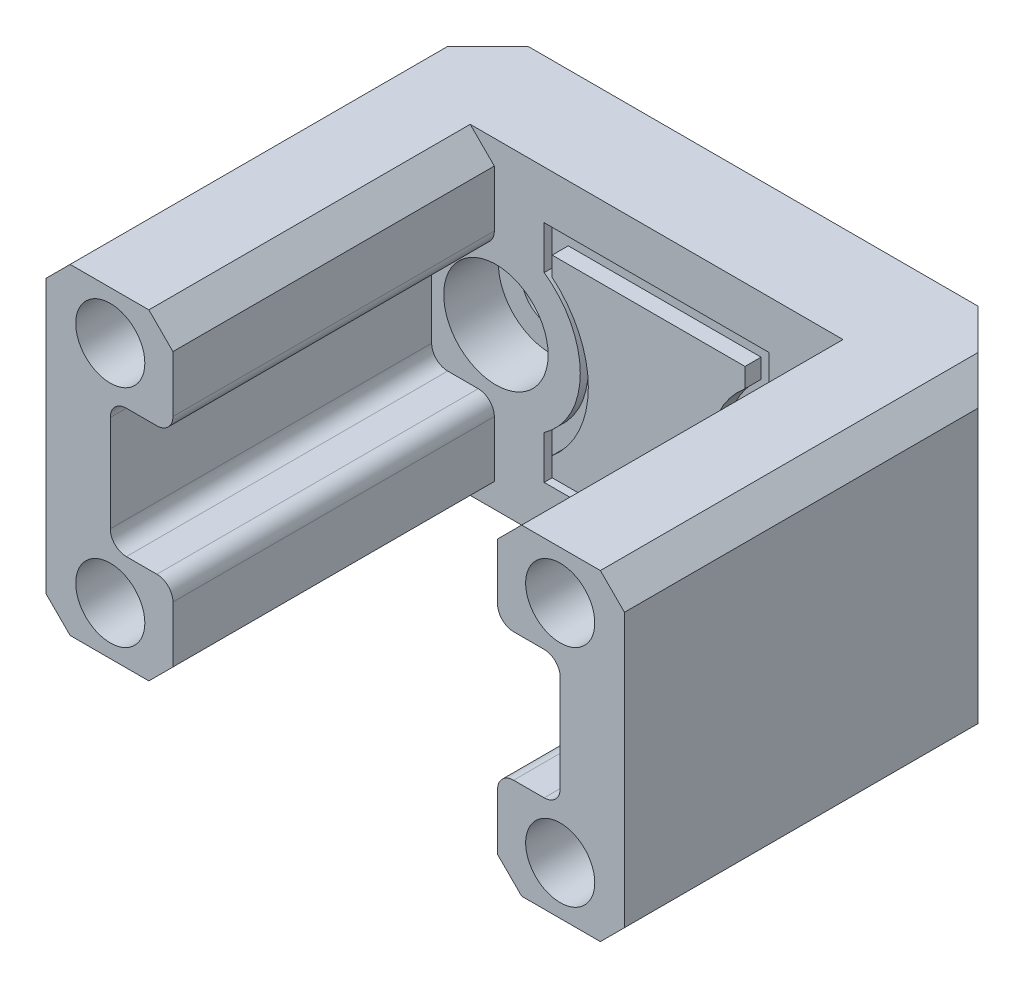
from build123d import *

# Parameters (mm, degrees)
SKETCH1_W                                           = 28
SKETCH1_H                                           = 20
BOSS_EXTRUDE1_DEPTH                                 = 6
CBORE_FOR_M3_HEX_SOCKET_HEAD_CAP_SCREW1_D           = 3.6
CBORE_FOR_M3_HEX_SOCKET_HEAD_CAP_SCREW1_CBORE_D     = 6.5
CBORE_FOR_M3_HEX_SOCKET_HEAD_CAP_SCREW1_CBORE_DEPTH = 3.4
SKETCH5_W                                           = 3.9
SKETCH5_H                                           = 6
BOSS_EXTRUDE2_DEPTH                                 = 20
SKETCH6_W                                           = 4
SKETCH6_H                                           = 20
BOSS_EXTRUDE3_DEPTH                                 = 26
FILLET1_R                                           = 1
F_4_3_4_3_DIAMETER_HOLE1_D                          = 4.3
F_4_3_4_3_DIAMETER_HOLE1_DEPTH                      = 10
F_4_3_4_3_DIAMETER_HOLE1_TIP                        = 1.291850331
CHAMFER1_SIZE                                       = 1.5
CUT_EXTRUDE1_DEPTH                                  = 0.5
BOSS_EXTRUDE4_DEPTH                                 = 1
CHAMFER3_SIZE                                       = 4


with BuildPart() as part:
    # Sketch1 → Boss-Extrude1 (new body)
    with BuildSketch(Plane.XY):
        with Locations((14, 10)):
            Rectangle(SKETCH1_W, SKETCH1_H)
    extrude(amount=BOSS_EXTRUDE1_DEPTH)

    # CBORE for M3 Hex Socket Head Cap Screw1 (through all)
    with Locations(Plane.XY.offset(6)):
        with Locations((4, 10), (24, 10)):
            CounterBoreHole(CBORE_FOR_M3_HEX_SOCKET_HEAD_CAP_SCREW1_D / 2, CBORE_FOR_M3_HEX_SOCKET_HEAD_CAP_SCREW1_CBORE_D / 2, CBORE_FOR_M3_HEX_SOCKET_HEAD_CAP_SCREW1_CBORE_DEPTH)

    # Sketch5 → Boss-Extrude2 (add)
    with BuildSketch(Plane.XY.offset(6)):
        with Locations((26.05, 17)):
            Rectangle(SKETCH5_W, SKETCH5_H)
        with Locations((1.95, 17)):
            Rectangle(SKETCH5_W, SKETCH5_H)
        with Locations((26.05, 3)):
            Rectangle(SKETCH5_W, SKETCH5_H)
        with Locations((1.95, 3)):
            Rectangle(SKETCH5_W, SKETCH5_H)
    extrude(amount=BOSS_EXTRUDE2_DEPTH)

    # Sketch6 → Boss-Extrude3 (add)
    with BuildSketch(Plane(origin=(0, 0, 0), x_dir=(-1, 0, 0), z_dir=(0, 0, -1))):
        with Locations((-30, 10)):
            Rectangle(SKETCH6_W, SKETCH6_H)
        with Locations((2, 10)):
            Rectangle(SKETCH6_W, SKETCH6_H)
    extrude(amount=-BOSS_EXTRUDE3_DEPTH)

    # Fillet1
    fillet1_edges = [part.edges().sort_by_distance(p)[0] for p in [
        (0, 14, 16),
        (3.9, 14, 16),
        (24.1, 14, 16),
        (28, 14, 16),
        (28, 6, 16),
        (24.1, 6, 16),
        (3.9, 6, 16),
        (0, 6, 16),
    ]]
    fillet(fillet1_edges, radius=FILLET1_R)

    # Ø4.3 (4.3) Diameter Hole1
    with Locations(Plane.XY.offset(26)):
        with Locations((28, 17), (0, 17), (0, 3), (28, 3)):
            Hole(F_4_3_4_3_DIAMETER_HOLE1_D / 2, depth=F_4_3_4_3_DIAMETER_HOLE1_DEPTH)
            with Locations((0, 0, -(F_4_3_4_3_DIAMETER_HOLE1_DEPTH + F_4_3_4_3_DIAMETER_HOLE1_TIP / 2))):  # 118° drill point
                Cone(0, F_4_3_4_3_DIAMETER_HOLE1_D / 2, F_4_3_4_3_DIAMETER_HOLE1_TIP, mode=Mode.SUBTRACT)

    # Chamfer1
    chamfer1_edges = [part.edges().sort_by_distance(p)[0] for p in [
        (3.9, 20, 16),
        (24.1, 20, 16),
        (24.1, 0, 16),
        (3.9, 0, 16),
        (32, 0, 13),
        (32, 20, 13),
        (-4, 20, 13),
        (-4, 0, 13),
    ]]
    chamfer(chamfer1_edges, length=CHAMFER1_SIZE)

    # Sketch9 → Cut-Extrude1 (cut)
    with BuildSketch(Plane.XY.offset(6)):
        with BuildLine():
            Line((21, 17), (7, 17))
            Line((7, 17), (7, 14.308421985))
            ThreePointArc((7, 14.308421985), (8.653627617, 12.430277762), (9.25, 10))
            ThreePointArc((9.25, 10), (8.653627617, 7.569722238), (7, 5.691578015))
            Line((7, 5.691578015), (7, 3))
            Line((7, 3), (21, 3))
            Line((21, 3), (21, 5.691578015))
            ThreePointArc((21, 5.691578015), (18.75, 10), (21, 14.308421985))
            Line((21, 14.308421985), (21, 17))
        make_face()
    extrude(amount=-CUT_EXTRUDE1_DEPTH, mode=Mode.SUBTRACT)

    # Chamfer3
    chamfer3_edges = [part.edges().sort_by_distance(p)[0] for p in [
        (-4, 10, 0),
        (32, 10, 0),
    ]]
    chamfer(chamfer3_edges, length=CHAMFER3_SIZE)


with BuildPart() as body_2:
    # Sketch10 → Boss-Extrude4 (new body)
    with BuildSketch(Plane.XY.offset(5.5)):
        with BuildLine():
            ThreePointArc((8, 5.197656822), (10.25, 10), (8, 14.802343178))
            Line((8, 14.802343178), (8, 16))
            Line((8, 16), (20, 16))
            Line((20, 16), (20, 14.802343178))
            ThreePointArc((20, 14.802343178), (17.75, 10), (20, 5.197656822))
            Line((20, 5.197656822), (20, 4))
            Line((20, 4), (8, 4))
            Line((8, 4), (8, 5.197656822))
        make_face()
    extrude(amount=BOSS_EXTRUDE4_DEPTH)


solid = Compound([part.part, body_2.part])
